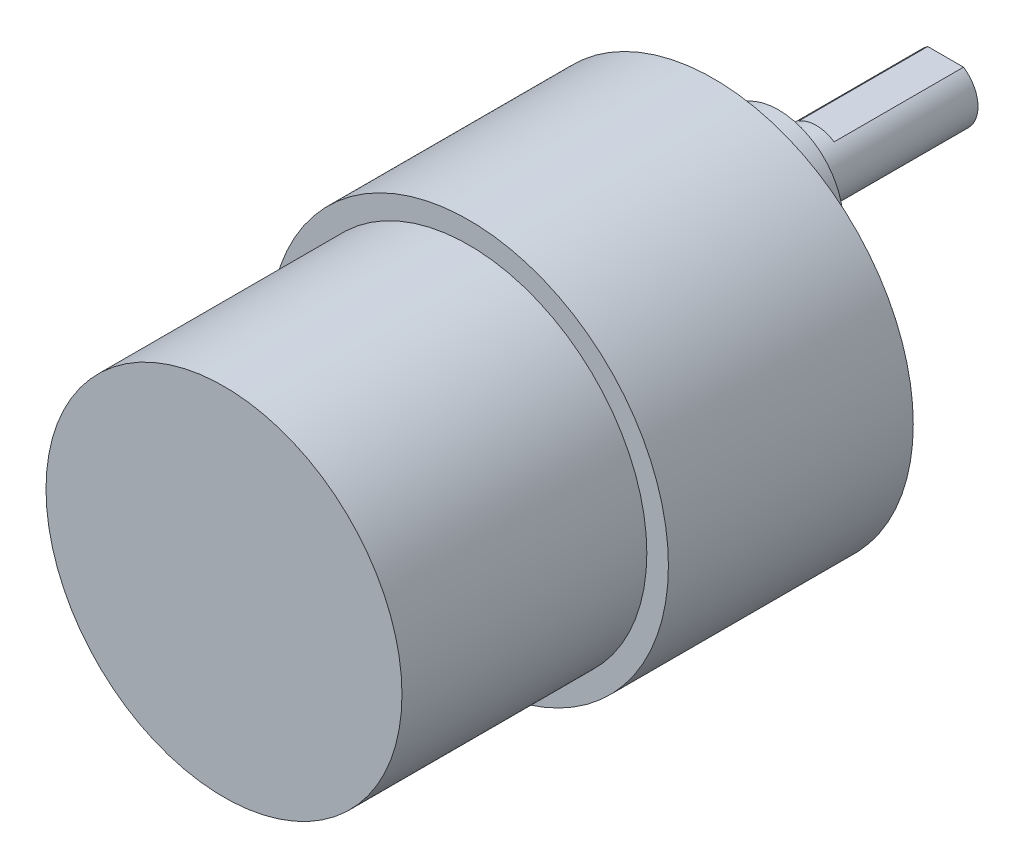
from build123d import *

# Parameters (mm, degrees)
SKETCH_1_R          = 18.5
EXTRUDE_1_DEPTH     = 22.7
SKETCH_2_R          = 16.5
EXTRUDE_2_DEPTH     = 22.7
SKETCH_3_R          = 6
EXTRUDE_3_DEPTH     = 6
SKETCH_4_R          = 3
EXTRUDE_4_DEPTH     = 15.5
SKETCH_5_W          = 14.350775589
SKETCH_5_H          = 3.642889188
CUT_EXTRUDE_1_DEPTH = 12
SKETCH_6_R          = 1.6
CUT_EXTRUDE_2_DEPTH = 10


with BuildPart() as part:
    # 草图1 → 凸台-拉伸1 (new body)
    with BuildSketch(Plane.XY):
        Circle(SKETCH_1_R)
    extrude(amount=EXTRUDE_1_DEPTH)

    # 草图2 → 凸台-拉伸2 (add)
    with BuildSketch(Plane.XY.offset(22.7)):
        Circle(SKETCH_2_R)
    extrude(amount=EXTRUDE_2_DEPTH)

    # 草图3 → 凸台-拉伸3 (add)
    with BuildSketch(Plane(origin=(0, 0, 0), x_dir=(-1, 0, 0), z_dir=(0, 0, -1))):
        with Locations(Location((0, 7, 0), (0, 0, 180))):
            Circle(SKETCH_3_R)
    extrude(amount=EXTRUDE_3_DEPTH)

    # 草图4 → 凸台-拉伸4 (add)
    with BuildSketch(Plane(origin=(0, 0, -6), x_dir=(-1, 0, 0), z_dir=(0, 0, -1))):
        with Locations((0, 7)):
            Circle(SKETCH_4_R)
    extrude(amount=EXTRUDE_4_DEPTH)

    # 草图5 → 切除-拉伸1 (cut)
    with BuildSketch(Plane(origin=(0, 0, -21.5), x_dir=(-1, 0, 0), z_dir=(0, 0, -1))):
        with Locations((0.938319943, 11.321444594)):
            Rectangle(SKETCH_5_W, SKETCH_5_H)
    extrude(amount=-CUT_EXTRUDE_1_DEPTH, mode=Mode.SUBTRACT)

    # 草图6 → 切除-拉伸2 (cut)
    with BuildSketch(Plane(origin=(0, 0, 0), x_dir=(-1, 0, 0), z_dir=(0, 0, -1))):
        with Locations((0, 15.5)):
            Circle(SKETCH_6_R)
        with Locations((13.423393759, 7.75)):
            Circle(SKETCH_6_R)
        with Locations((13.423393759, -7.75)):
            Circle(SKETCH_6_R)
        with Locations((0, -15.5)):
            Circle(SKETCH_6_R)
        with Locations((-13.423393759, -7.75)):
            Circle(SKETCH_6_R)
        with Locations((-13.423393759, 7.75)):
            Circle(SKETCH_6_R)
    extrude(amount=-CUT_EXTRUDE_2_DEPTH, mode=Mode.SUBTRACT)


solid = part.part
